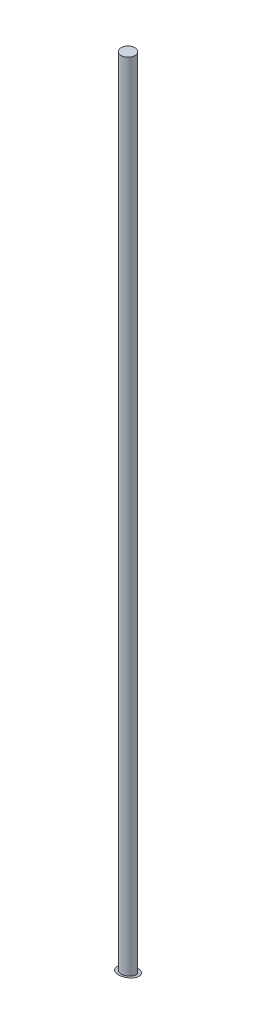
from build123d import *

# Parameters (mm, degrees)
SKETCH_1_R          = 1.25
EXTRUDE_1_DEPTH     = 145
CUT_EXTRUDE_1_DEPTH = 6
SKETCH_4_R          = 1.75
EXTRUDE_3_DEPTH     = 2
EXTRUDE_3_TAPER     = 64


with BuildPart() as part:
    # Эскиз1 → Бобышка-Вытянуть1 (new body)
    with BuildSketch(Plane(origin=(0, 0, 0), x_dir=(1, 0, 0), z_dir=(0, 1, 0))):
        with Locations(Location((0, 0, 0), (0, 0, 270))):
            Circle(SKETCH_1_R)
    extrude(amount=EXTRUDE_1_DEPTH)

    # Эскиз3 → Вырез-Вытянуть1 (cut, symmetric)
    with BuildSketch(Plane(origin=(0, 0, 0), x_dir=(0, 0, -1), z_dir=(1, 0, 0))):
        Polygon((1.25, 0), (-2.080626709, 0.599874475), (-2.080626709, 0), align=None)
    extrude(amount=CUT_EXTRUDE_1_DEPTH, both=True, mode=Mode.SUBTRACT)

    # Эскиз4 → Бобышка-Вытянуть3 (add)
    with BuildSketch(Plane(origin=(0, 0.218062, -0.039274839), x_dir=(1, 0, 0), z_dir=(0, -0.9841646858615077, 0.177256512159977))):
        with Locations((0, 0.040379775)):
            Circle(SKETCH_4_R)
    extrude(amount=EXTRUDE_3_DEPTH, taper=EXTRUDE_3_TAPER)


solid = part.part
